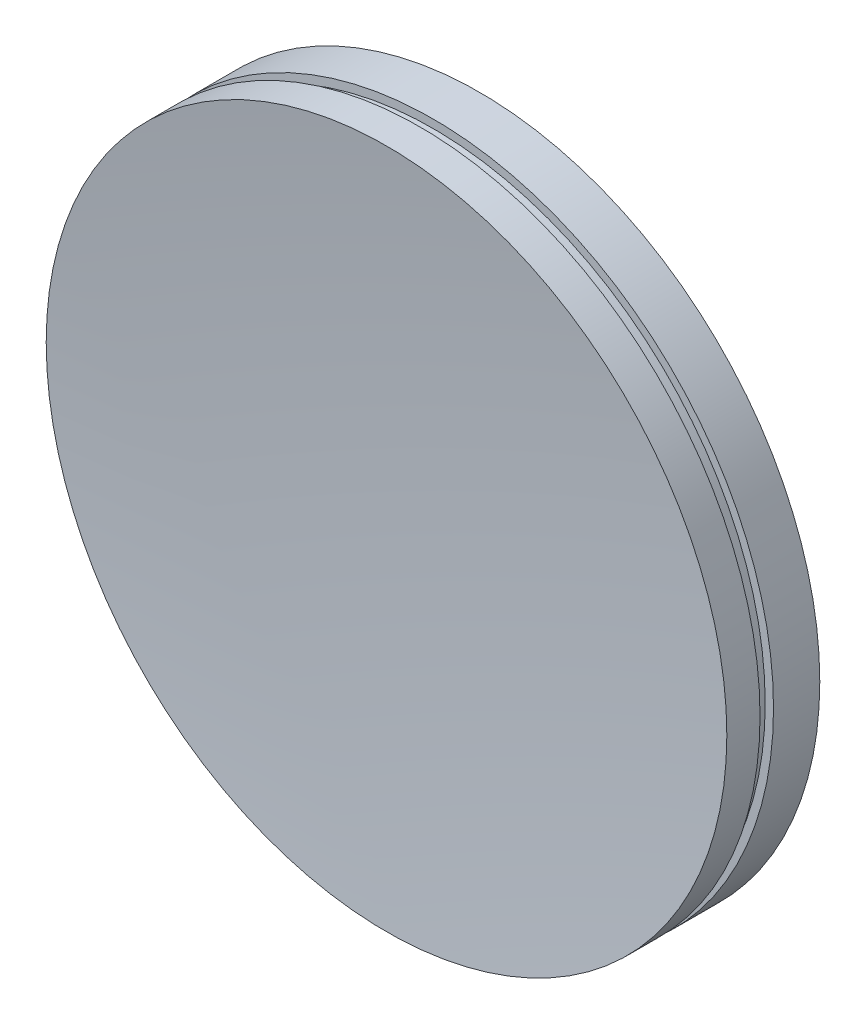
from build123d import *

# Parameters (mm, degrees)
ESQUISSE1_R        = 205
BOSS_EXTRU_1_DEPTH = 56
ESQUISSE3_W        = 5
ESQUISSE3_H        = 8.12


with BuildPart() as part:
    # Esquisse1 → Boss.-Extru.1 (new body)
    with BuildSketch(Plane.XY):
        Circle(ESQUISSE1_R)
    extrude(amount=BOSS_EXTRU_1_DEPTH)

    # Esquisse2 → Enlèvement de matière-Révolution6 (revolve, cut)
    with BuildSketch(Plane(origin=(0, 0, 0), x_dir=(1, 0, 0), z_dir=(0, 1, 0))):
        with BuildLine():
            Line((0, -2095.724246069), (0, -45.724246069))
            ThreePointArc((0, -45.724246069), (1449.568901432, -646.155344636), (2050, -2095.724246069))
            Line((2050, -2095.724246069), (0, -2095.724246069))
        make_face()
    revolve(axis=Axis((0, 0, 0), (0, 0, 1)), mode=Mode.SUBTRACT)

    # Esquisse3 → Enlèvement de matière-Révolution7 (revolve, cut)
    with BuildSketch(Plane(origin=(0, 0, 0), x_dir=(1, 0, 0), z_dir=(0, 1, 0))):
        with Locations((202.5, -31.94)):
            Rectangle(ESQUISSE3_W, ESQUISSE3_H)
    revolve(axis=Axis((0, 0, 2095.724246069), (0, 0, -1)), mode=Mode.SUBTRACT)


solid = part.part
